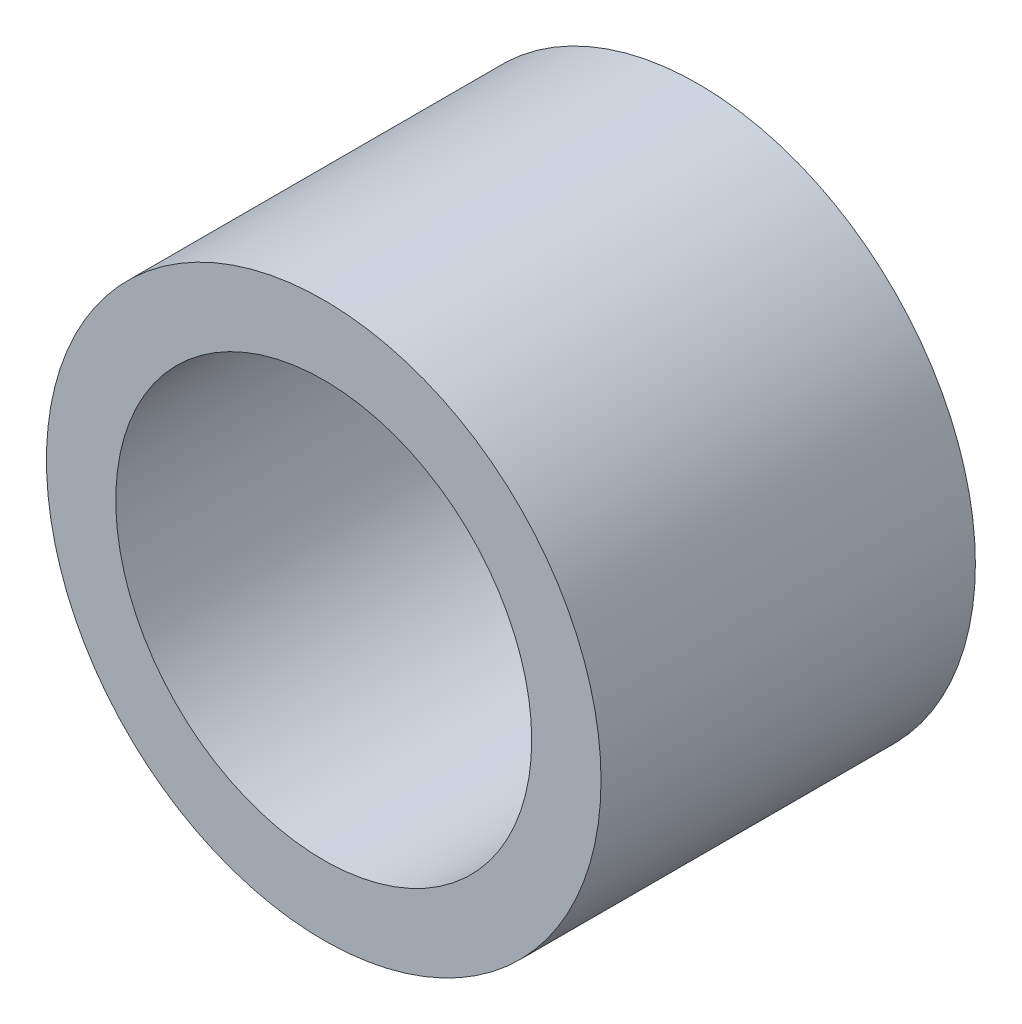
from build123d import *

# Parameters (mm, degrees)
SKETCH_2_W = 13.5
SKETCH_2_H = 2.5


with BuildPart() as part:
    # ｽｹｯﾁ2 → 回転1 (revolve)
    with BuildSketch(Plane(origin=(0, 0, 0), x_dir=(0, 0, -1), z_dir=(1, 0, 0))):
        with Locations((6.75, 8.75)):
            Rectangle(SKETCH_2_W, SKETCH_2_H)
    revolve(axis=Axis((0, 0, 0), (0, 0, -1)))


solid = part.part
